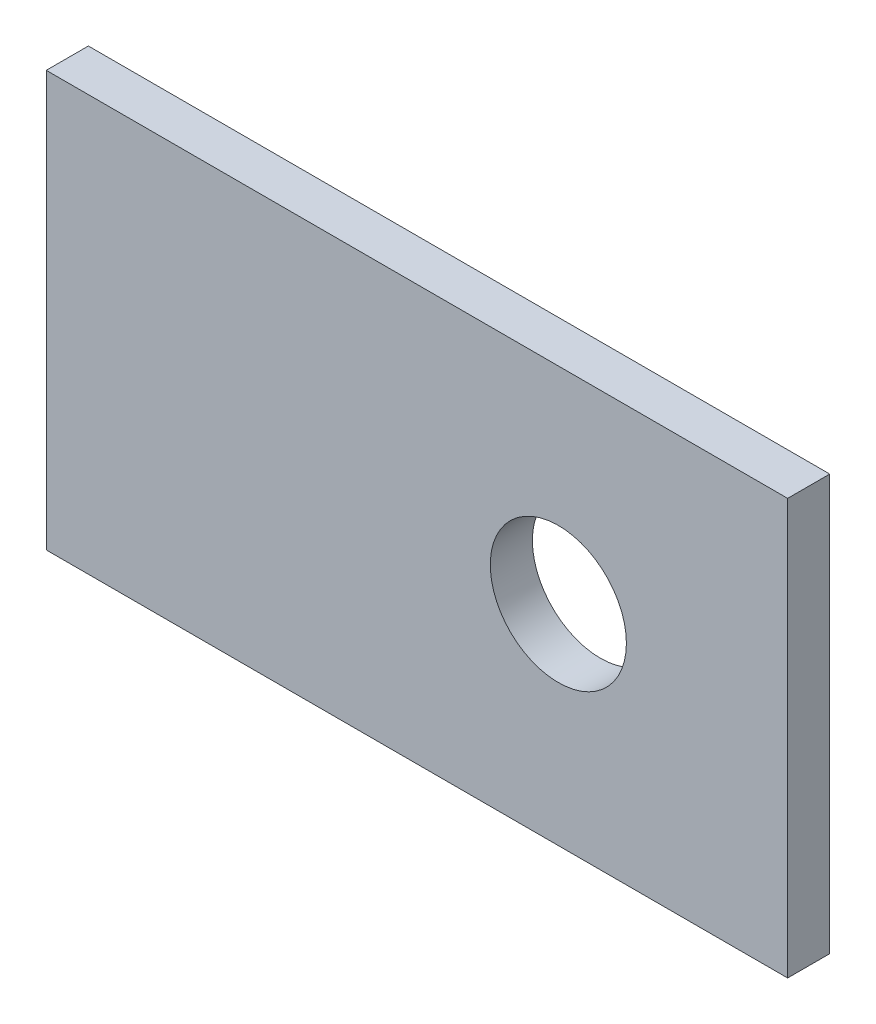
from build123d import *

# Parameters (mm, degrees)
SKETCH1_W           = 52.83
SKETCH1_H           = 29.6
BOSS_EXTRUDE1_DEPTH = 3
SKETCH2_R           = 4.85
CUT_EXTRUDE1_DEPTH  = 10


with BuildPart() as part:
    # Sketch1 → Boss-Extrude1 (new body)
    with BuildSketch(Plane.XY):
        Rectangle(SKETCH1_W, SKETCH1_H)
    extrude(amount=BOSS_EXTRUDE1_DEPTH)

    # Sketch2 → Cut-Extrude1 (cut)
    with BuildSketch(Plane.XY.offset(3)):
        with Locations((10.075, 0.11)):
            Circle(SKETCH2_R)
    extrude(amount=-CUT_EXTRUDE1_DEPTH, mode=Mode.SUBTRACT)


solid = part.part
